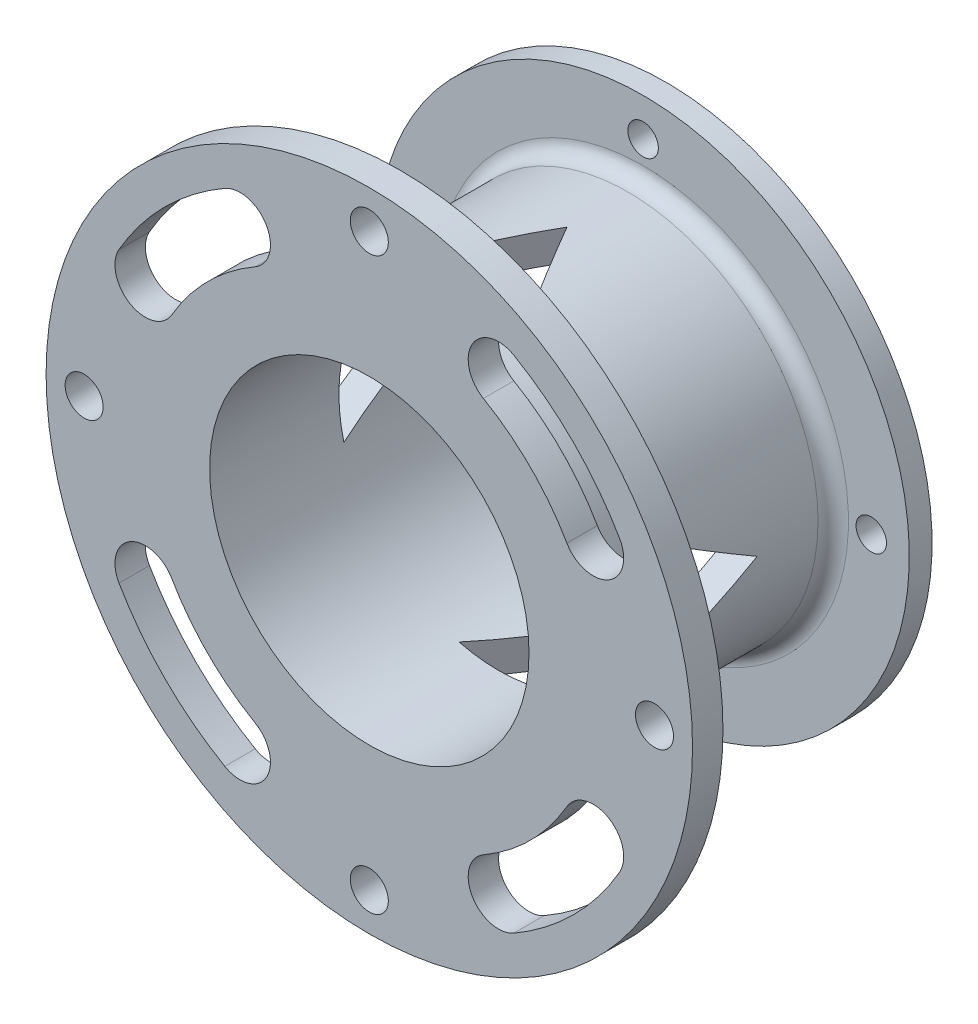
from build123d import *

# Parameters (mm, degrees)
SKETCH_1_R               = 25
SKETCH_1_R_2             = 21
EXTRUDE_1_DEPTH          = 39
EXTRUDE_START            = -4
SKETCH_2_R               = 42.5
SKETCH_2_R_2             = 21
EXTRUDE_2_DEPTH          = 4
SKETCH_3_R               = 2.5
CUT_EXTRUDE_1_DEPTH      = 4
SKETCH_4_R               = 35
SKETCH_4_R_2             = 21
EXTRUDE_3_DEPTH          = 3
SKETCH_5_R               = 2
CUT_EXTRUDE_2_DEPTH      = 3
FILLET_1_R               = 2
CUT_EXTRUDE_3_DEPTH      = 42
PATTERN_CIRCULAR_1_COUNT = 4
CUT_EXTRUDE_4_DEPTH      = 5


with BuildPart() as part:
    # 草图1 → 凸台-拉伸1 (new body)
    with BuildSketch(Plane.XY):
        Circle(SKETCH_1_R)
        Circle(SKETCH_1_R_2, mode=Mode.SUBTRACT)
    extrude(amount=EXTRUDE_1_DEPTH)

    # 草图2 → 凸台-拉伸2 (add)
    with BuildSketch(Plane.XY.offset(39).offset(EXTRUDE_START)):
        Circle(SKETCH_2_R)
        Circle(SKETCH_2_R_2, mode=Mode.SUBTRACT)
    extrude(amount=EXTRUDE_2_DEPTH)

    # 草图3 → 切除-拉伸1 (cut)
    with BuildSketch(Plane.XY.offset(39)):
        with Locations((0, 37.5)):
            Circle(SKETCH_3_R)
        with Locations((37.5, 0)):
            Circle(SKETCH_3_R)
        with Locations((0, -37.5)):
            Circle(SKETCH_3_R)
        with Locations((-37.5, 0)):
            Circle(SKETCH_3_R)
    extrude(amount=-CUT_EXTRUDE_1_DEPTH, mode=Mode.SUBTRACT)

    # 草图4 → 凸台-拉伸3 (add)
    with BuildSketch(Plane(origin=(0, 0, 0), x_dir=(-1, 0, 0), z_dir=(0, 0, -1))):
        Circle(SKETCH_4_R)
        with Locations(Location((0, 0, 0), (0, 0, 180))):
            Circle(SKETCH_4_R_2, mode=Mode.SUBTRACT)
    extrude(amount=-EXTRUDE_3_DEPTH)

    # 草图5 → 切除-拉伸2 (cut)
    with BuildSketch(Plane(origin=(0, 0, 0), x_dir=(-1, 0, 0), z_dir=(0, 0, -1))):
        with Locations((0, 30)):
            Circle(SKETCH_5_R)
        with Locations((30, 0)):
            Circle(SKETCH_5_R)
        with Locations((0, -30)):
            Circle(SKETCH_5_R)
        with Locations((-30, 0)):
            Circle(SKETCH_5_R)
    extrude(amount=-CUT_EXTRUDE_2_DEPTH, mode=Mode.SUBTRACT)

    # 圆角1
    fillet_1_edges = [part.edges().sort_by_distance(p)[0] for p in [
        (-25, 0, 35),
        (-25, 0, 3),
    ]]
    fillet(fillet_1_edges, radius=FILLET_1_R)

    # 草图6 → 切除-拉伸3 (cut)
    with BuildSketch(Plane(origin=(0, 0, 0), x_dir=(0, 0, -1), z_dir=(1, 0, 0))):
        Polygon((-13, 0), (-22, 5.196152423), (-22, -5.196152423), align=None)
    cut_extrude_3 = extrude(amount=-CUT_EXTRUDE_3_DEPTH, mode=Mode.SUBTRACT)

    # 阵列(圆周)1: 切除-拉伸3 ×4 about axis
    pattern_circular_1_axis = Axis((0, 0, 0), (0, 0, 1))
    for i in range(1, PATTERN_CIRCULAR_1_COUNT):
        add(cut_extrude_3.rotate(pattern_circular_1_axis, i * 360 / PATTERN_CIRCULAR_1_COUNT), mode=Mode.SUBTRACT)

    # 草图7 → 切除-拉伸4 (cut)
    with BuildSketch(Plane.XY.offset(39)):
        with BuildLine():
            ThreePointArc((-19, 32.908965344), (-26.870057685, 26.870057685), (-32.908965344, 19))
            ThreePointArc((-32.908965344, 19), (-31.444863729, 13.535898385), (-25.980762114, 15))
            ThreePointArc((-25.980762114, 15), (-21.213203436, 21.213203436), (-15, 25.980762114))
            ThreePointArc((-15, 25.980762114), (-13.535898385, 31.444863729), (-19, 32.908965344))
        make_face()
        with BuildLine():
            ThreePointArc((25.980762114, 15), (21.213203436, 21.213203436), (15, 25.980762114))
            ThreePointArc((15, 25.980762114), (13.535898385, 31.444863729), (19, 32.908965344))
            ThreePointArc((19, 32.908965344), (26.870057685, 26.870057685), (32.908965344, 19))
            ThreePointArc((32.908965344, 19), (31.444863729, 13.535898385), (25.980762114, 15))
        make_face()
        with BuildLine():
            ThreePointArc((15, -25.980762114), (21.213203436, -21.213203436), (25.980762114, -15))
            ThreePointArc((25.980762114, -15), (31.444863729, -13.535898385), (32.908965344, -19))
            ThreePointArc((32.908965344, -19), (26.870057685, -26.870057685), (19, -32.908965344))
            ThreePointArc((19, -32.908965344), (13.535898385, -31.444863729), (15, -25.980762114))
        make_face()
        with BuildLine():
            ThreePointArc((-25.980762114, -15), (-21.213203436, -21.213203436), (-15, -25.980762114))
            ThreePointArc((-15, -25.980762114), (-13.535898385, -31.444863729), (-19, -32.908965344))
            ThreePointArc((-19, -32.908965344), (-26.870057685, -26.870057685), (-32.908965344, -19))
            ThreePointArc((-32.908965344, -19), (-31.444863729, -13.535898385), (-25.980762114, -15))
        make_face()
    extrude(amount=-CUT_EXTRUDE_4_DEPTH, mode=Mode.SUBTRACT)


solid = part.part
